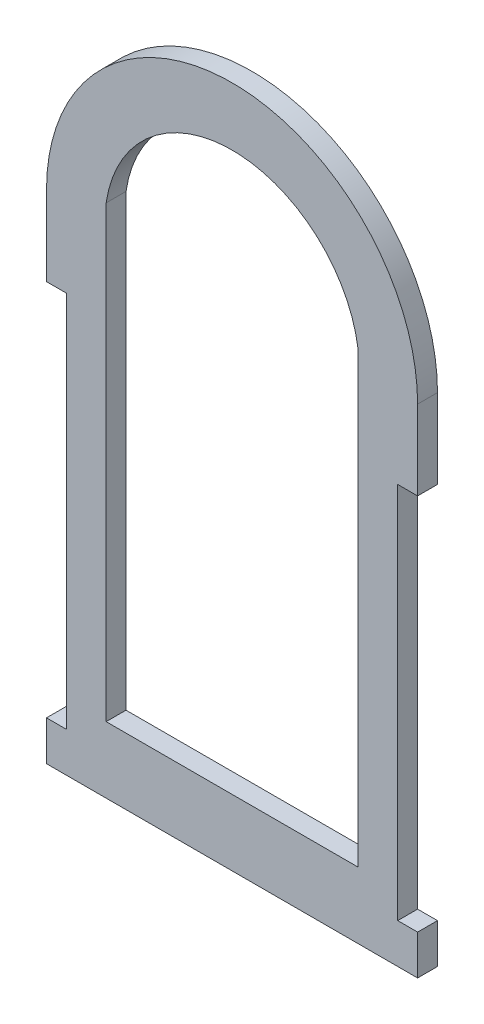
from build123d import *

# Parameters (mm, degrees)
BOSS_EXTRUDE1_DEPTH = 3
SKETCH2_W           = 38
SKETCH2_H           = 10
BOSS_EXTRUDE2_DEPTH = 3


with BuildPart() as part:
    # Sketch1 → Boss-Extrude1 (new body)
    with BuildSketch(Plane.XY):
        with BuildLine():
            ThreePointArc((-19, 76.795454546), (-12.552472511, 88.534441856), (0, 93.204545458))
            Line((0, 93.204545458), (0, 102))
            ThreePointArc((0, 102.000000004), (-19.799000732, 93.798979019), (-28, 73.999969292))
            Line((-28, 73.999969292), (-28, 68))
            Line((-28, 68), (-19, 68))
            Line((-19, 68), (-19, 76.795454546))
        make_face()
        with BuildLine():
            Line((0, 102), (0, 93.204545458))
            ThreePointArc((0, 93.204545458), (12.552472511, 88.534441856), (19, 76.795454546))
            Line((19, 76.795454546), (19, 68))
            Line((19, 68), (28, 68))
            Line((28, 68), (28, 73.999969292))
            ThreePointArc((28, 73.999969292), (19.799000732, 93.798979019), (0, 102.000000004))
        make_face()
        Polygon((-19, -1), (-19, 5), (-19, 68), (-28, 68), (-28, 62), (-25, 62), (-25, 5), (-28, 5), (-28, -1), align=None)
        Polygon((19, 68), (19, 5), (19, -1), (28, -1), (28, 5), (25, 5), (25, 62), (28, 62), (28, 68), align=None)
    extrude(amount=BOSS_EXTRUDE1_DEPTH)

    # Sketch2 → Boss-Extrude2 (add)
    with BuildSketch(Plane.XY.offset(3)):
        with Locations((0, 4)):
            Rectangle(SKETCH2_W, SKETCH2_H)
    extrude(amount=-BOSS_EXTRUDE2_DEPTH)


solid = part.part
